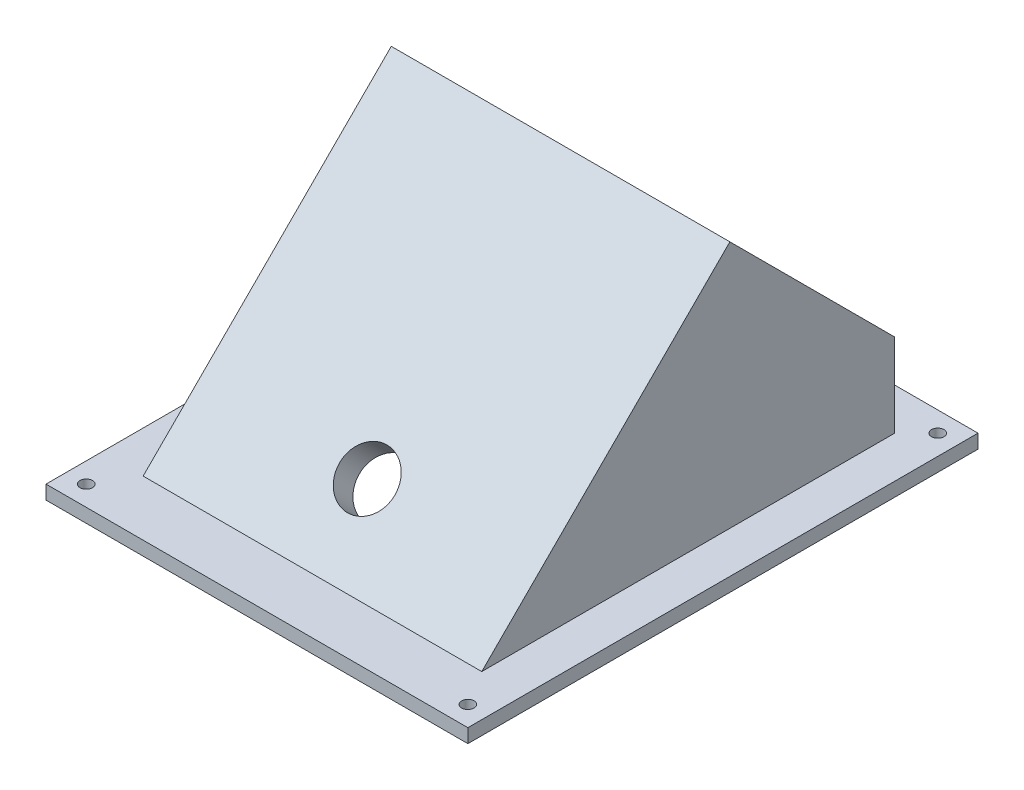
from build123d import *

# Parameters (mm, degrees)
ESTRUSIONE_ESTRUSIONE1_DEPTH = 122
SCHIZZO2_W                   = 72
SCHIZZO2_H                   = 55
TAGLIO_ESTRUSIONE1_DEPTH     = 40
SVUOTA1_T                    = -10
SCHIZZO3_R                   = 10
TAGLIO_ESTRUSIONE2_DEPTH     = 40
SCHIZZO4_R                   = 10
TAGLIO_ESTRUSIONE3_DEPTH     = 40
SCHIZZO5_W                   = 152
SCHIZZO5_H                   = 183.793939239
SCHIZZO5_W_2                 = 112
SCHIZZO5_H_2                 = 139.651803616
ESTRUSIONE_ESTRUSIONE2_DEPTH = 5
FORO_PER_VITE_M4_1_D         = 4.5
FORO_PER_VITE_M4_1_DEPTH     = 5
FORO_PER_VITE_M4_1_TIP       = 1.351936393


with BuildPart() as part:
    # Schizzo1 → Estrusione-Estrusione1 (new body)
    with BuildSketch(Plane(origin=(0, 0, 0), x_dir=(0, 0, -1), z_dir=(1, 0, 0))):
        Polygon((0, 0), (0, 35), (-59.39696962, 94.39696962), (-153.793939239, 0), align=None)
    extrude(amount=ESTRUSIONE_ESTRUSIONE1_DEPTH)

    # Schizzo2 → Taglio-Estrusione1 (cut)
    with BuildSketch(Plane(origin=(0, 17.5, -17.5), x_dir=(1, 0, 0), z_dir=(0, 0.7071067811865489, -0.7071067811865461))):
        with Locations((61, -66.748737342)):
            Rectangle(SCHIZZO2_W, SCHIZZO2_H)
    extrude(amount=-TAGLIO_ESTRUSIONE1_DEPTH, mode=Mode.SUBTRACT)

    # Svuota1
    svuota1_openings = [part.faces().sort_by_distance(p)[0] for p in [
        (61, 0, 76.89696962),
    ]]
    offset(amount=SVUOTA1_T, openings=svuota1_openings, kind=Kind.INTERSECTION)

    # Schizzo3 → Taglio-Estrusione2 (cut)
    with BuildSketch(Plane(origin=(0, -10.784271247, 10.784271247), x_dir=(1, 0, 0), z_dir=(0, 0.7071067811865489, -0.7071067811865462))):
        with Locations(Location((61, -66.748737342, 0), (0, 0, 270))):
            Circle(SCHIZZO3_R)
    extrude(amount=-TAGLIO_ESTRUSIONE2_DEPTH, mode=Mode.SUBTRACT)

    # Schizzo4 → Taglio-Estrusione3 (cut)
    with BuildSketch(Plane(origin=(0, 69.825901808, 69.825901808), x_dir=(1, 0, 0), z_dir=(0, -0.7071067811865461, -0.707106781186549))):
        with Locations(Location((61, 73.748737342, 0), (0, 0, 270))):
            Circle(SCHIZZO4_R)
    extrude(amount=-TAGLIO_ESTRUSIONE3_DEPTH, mode=Mode.SUBTRACT)

    # Schizzo5 → Estrusione-Estrusione2 (add)
    with BuildSketch(Plane.XZ):
        with Locations((61, 76.896969619)):
            Rectangle(SCHIZZO5_W, SCHIZZO5_H)
        with Locations((66, 69.825901808)):
            Rectangle(SCHIZZO5_W_2, SCHIZZO5_H_2, mode=Mode.SUBTRACT)
    extrude(amount=-ESTRUSIONE_ESTRUSIONE2_DEPTH)

    # Foro per Vite M4-1
    with Locations(Plane(origin=(0, 5, 0), x_dir=(1, 0, 0), z_dir=(0, 1, 0))):
        with Locations((-7.75, -161.543939239), (129.75, -161.543939239), (129.75, 7.75), (-7.75, 7.75)):
            Hole(FORO_PER_VITE_M4_1_D / 2, depth=FORO_PER_VITE_M4_1_DEPTH)
            with Locations((0, 0, -(FORO_PER_VITE_M4_1_DEPTH + FORO_PER_VITE_M4_1_TIP / 2))):  # 118° drill point
                Cone(0, FORO_PER_VITE_M4_1_D / 2, FORO_PER_VITE_M4_1_TIP, mode=Mode.SUBTRACT)


solid = part.part
